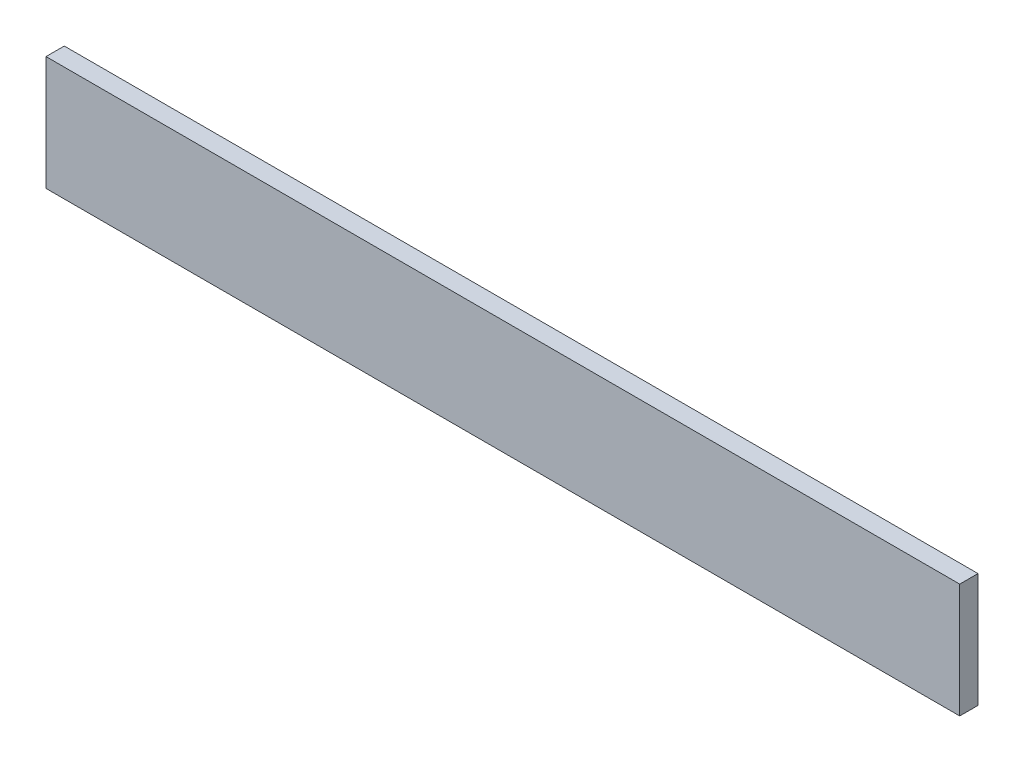
from build123d import *

# Parameters (mm, degrees)
SKETCH2_W           = 160
SKETCH2_H           = 20
BOSS_EXTRUDE1_DEPTH = 3.2


with BuildPart() as part:
    # Sketch2 → Boss-Extrude1 (new body)
    with BuildSketch(Plane(origin=(0, -10, 10), x_dir=(1, 0, 0), z_dir=(0, 0, -1))):
        with Locations((80, 0)):
            Rectangle(SKETCH2_W, SKETCH2_H)
    extrude(amount=BOSS_EXTRUDE1_DEPTH)


solid = part.part
